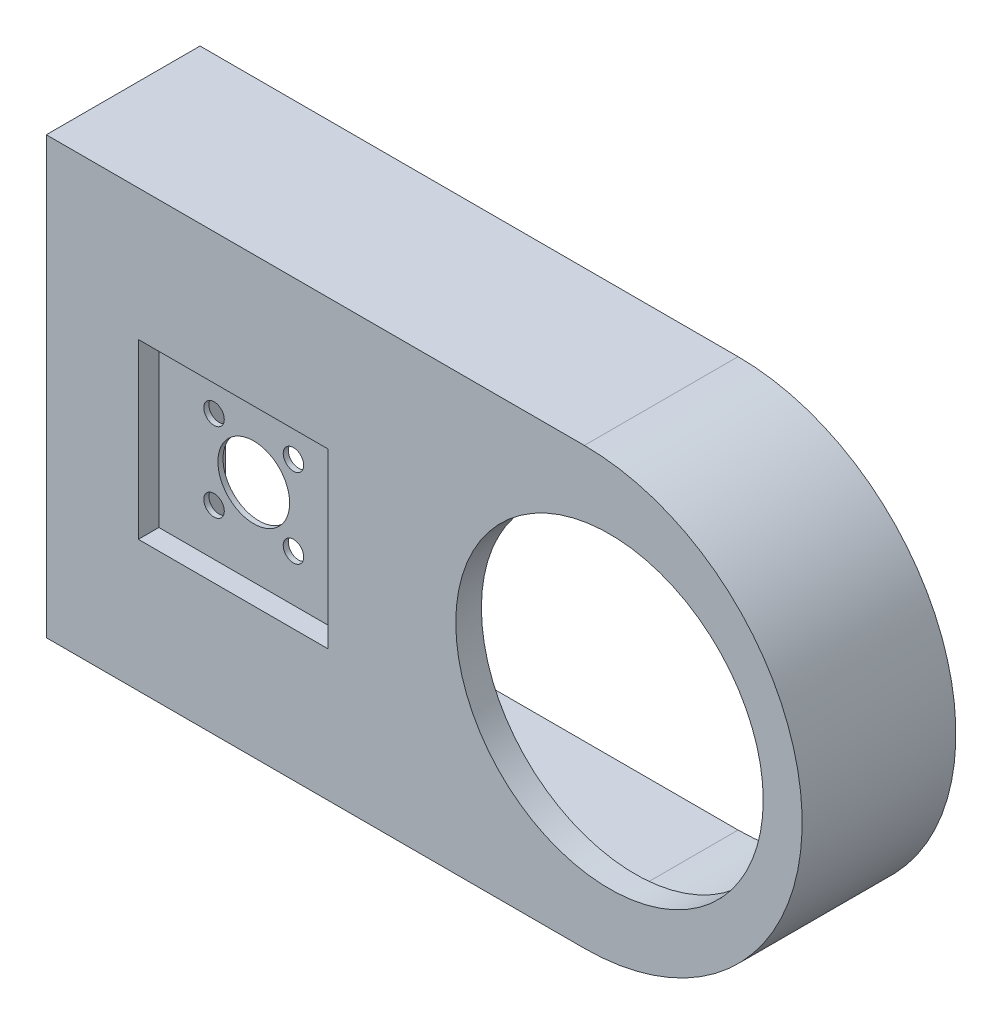
from build123d import *

# Parameters (mm, degrees)
EXTRUDE_THIN1_DEPTH = 60
BOSS_EXTRUDE1_DEPTH = 10
SKETCH2_R           = 60
CUT_EXTRUDE1_DEPTH  = 210.642552932
SKETCH3_W           = 74.064232883
SKETCH3_H           = 67.55464171
SKETCH3_R           = 14
CUT_EXTRUDE2_DEPTH  = 8
SKETCH3_2_R         = 14
CUT_EXTRUDE3_DEPTH  = 213.249852768
SKETCH7_R           = 4
CUT_EXTRUDE4_DEPTH  = 211.128532094


with BuildPart() as part:
    # Sketch1 → Extrude-Thin1 (new body)
    with BuildSketch(Plane.XY):
        with BuildLine():
            Line((100, 85), (-110, 85))
            Line((-110, 85), (-110, -85))
            Line((-110, -85), (100, -85))
            ThreePointArc((100, -85), (185, 0), (100, 85))
        make_face()
        with BuildLine():
            Line((100, 75), (-100, 75))
            Line((-100, 75), (-100, -75))
            Line((-100, -75), (100, -75))
            ThreePointArc((100, -75), (175, 0), (100, 75))
        make_face(mode=Mode.SUBTRACT)
    extrude(amount=-EXTRUDE_THIN1_DEPTH)

    # Sketch1<2> → Boss-Extrude1 (add)
    with BuildSketch(Plane.XY):
        with BuildLine():
            Line((-100, -75), (100, -75))
            ThreePointArc((100, -75), (175, 0), (100, 75))
            Line((100, 75), (-100, 75))
            Line((-100, 75), (-100, -75))
        make_face()
    extrude(amount=-BOSS_EXTRUDE1_DEPTH)

    # Sketch2 → Cut-Extrude1 (cut, through all)
    with BuildSketch(Plane(origin=(0, 0, -10), x_dir=(-1, 0, 0), z_dir=(0, 0, -1))):
        with Locations((-109.812010845, 0)):
            Circle(SKETCH2_R)
    extrude(amount=-CUT_EXTRUDE1_DEPTH, mode=Mode.SUBTRACT)

    # Sketch3 → Cut-Extrude2 (cut)
    with BuildSketch(Plane.XY):
        with Locations((-37.032116442, 0)):
            Rectangle(SKETCH3_W, SKETCH3_H)
        with Locations((-37.032116441, 0)):
            Circle(SKETCH3_R, mode=Mode.SUBTRACT)
    extrude(amount=-CUT_EXTRUDE2_DEPTH, mode=Mode.SUBTRACT)

    # Sketch3<2> → Cut-Extrude3 (cut, through all)
    with BuildSketch(Plane.XY):
        with Locations((-37.032116441, 0)):
            Circle(SKETCH3_2_R)
    extrude(amount=-CUT_EXTRUDE3_DEPTH, mode=Mode.SUBTRACT)

    # Sketch7 → Cut-Extrude4 (cut, through all)
    with BuildSketch(Plane.XY.offset(-8)):
        with Locations((-52.532116441, 15.5)):
            Circle(SKETCH7_R)
        with Locations((-21.532116441, 15.5)):
            Circle(SKETCH7_R)
        with Locations((-21.532116441, -15.5)):
            Circle(SKETCH7_R)
        with Locations((-52.532116441, -15.5)):
            Circle(SKETCH7_R)
    extrude(amount=-CUT_EXTRUDE4_DEPTH, mode=Mode.SUBTRACT)


solid = part.part
